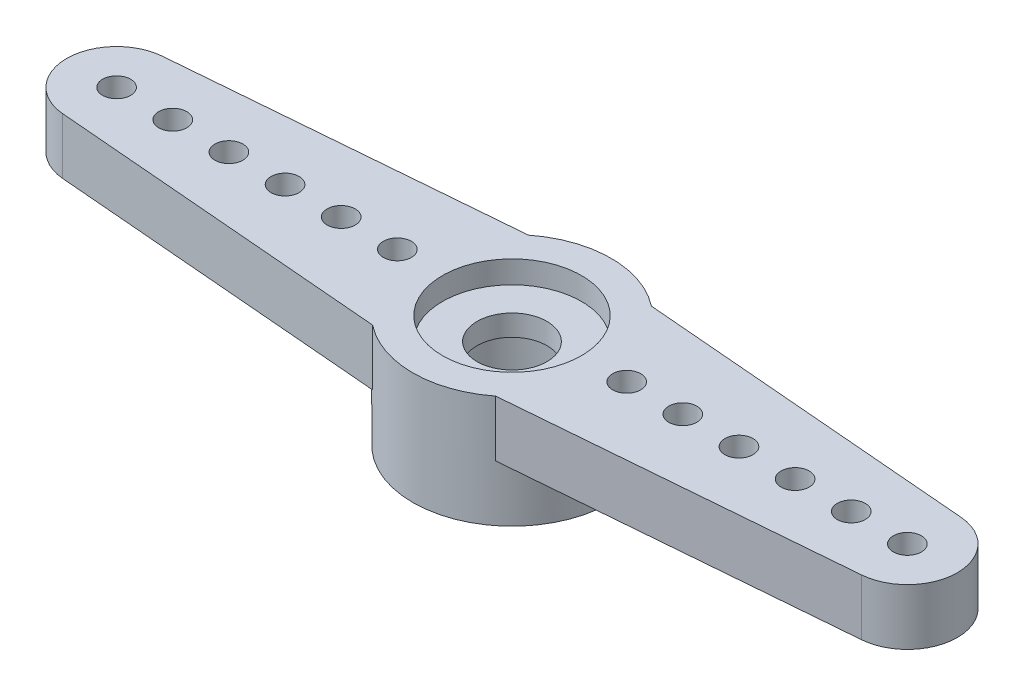
from build123d import *
from build123d.topology import SkipClean

# Parameters (mm, degrees)
BOSS_EXTRUDE1_START   = 2
BOSS_EXTRUDE1_DEPTH   = 2
MIRROR_START          = 2
MIRROR_2_COPY_1_DEPTH = 2
MIRROR_2_COPY_2_DEPTH = 2


with BuildPart() as part:
    # Sketch2 → Revolve1 (revolve)
    with BuildSketch(Plane.XY, mode=Mode.PRIVATE) as revolve1_sk:
        Polygon((2.475, 2), (2.475, 1.2), (1.245, 1.2), (1.245, 0.45), (2.375, 0.45), (2.375, -2), (3.535, -2), (3.535, 2), align=None)
    revolve(revolve1_sk.sketch.rotate(Axis((0, 55, 0), (0, -1, 0)), 90), axis=Axis((0, 55, 0), (0, -1, 0)))

    # Sketch3 → Boss-Extrude1 (add)
    with BuildSketch(Plane(origin=(0, 0, 0), x_dir=(1, 0, 0), z_dir=(0, 1, 0)).offset(BOSS_EXTRUDE1_START)):
        with BuildLine():
            ThreePointArc((3.535, 0), (3.180996027, -1.541910917), (2.189885842, -2.775))
            Line((2.189885842, -2.775), (14.232465575, -1.773881029))
            ThreePointArc((14.232465575, -1.773881029), (13.044016702, -1.443867644), (12.3554, -0.420575606))
            ThreePointArc((12.3554, -0.420575606), (11.845417029, -0.438862165), (11.585, 0))
            Line((11.585, 0), (10.585, 0))
            ThreePointArc((10.585, 0), (10.085, -0.5), (9.585, 0))
            Line((9.585, 0), (8.585, 0))
            ThreePointArc((8.585, 0), (8.085, -0.5), (7.585, 0))
            Line((7.585, 0), (6.585, 0))
            ThreePointArc((6.585, 0), (6.085, -0.5), (5.585, 0))
            Line((5.585, 0), (4.585, 0))
            ThreePointArc((4.585, 0), (4.085, -0.5), (3.585, 0))
            Line((3.585, 0), (3.535, 0))
        make_face()
        with BuildLine():
            ThreePointArc((12.3554, -0.420575606), (13.044016702, -1.443867644), (14.232465575, -1.773881029))
            ThreePointArc((14.232465575, -1.773881029), (15.394749733, -1.205386095), (15.865, 0))
            Line((15.865, 0), (14.585, 0))
            ThreePointArc((14.585, 0), (14.085, -0.5), (13.585, 0))
            Line((13.585, 0), (12.585, 0))
            ThreePointArc((12.585, 0), (12.523862165, -0.239582971), (12.3554, -0.420575606))
        make_face()
    boss_extrude1 = extrude(amount=-BOSS_EXTRUDE1_DEPTH)

    # Mirror1: Boss-Extrude1 across plane
    with SkipClean():  # the faces are left unmerged after this step: merging them gives an invalid solid
        add(boss_extrude1.mirror(Plane(origin=(0, 15.95383002, 0), x_dir=(1, 0, 0), z_dir=(0, 0, -1))))

    # 镜向1: Boss-Extrude1 across plane
    with SkipClean():  # the faces are left unmerged after this step: merging them gives an invalid solid
        add(boss_extrude1.mirror(Plane(origin=(0, 0, 0), x_dir=(0, 0, 1), z_dir=(1, 0, 0))))

    # 镜向2 copy 1 sketch → 镜向2 copy 1 (add)
    with SkipClean():  # the faces are left unmerged after this step: merging them gives an invalid solid
        with BuildSketch(Plane(origin=(0, 0, 0), x_dir=(-1, 0, 0), z_dir=(0, 1, 0)).offset(MIRROR_START)):
            with BuildLine():
                ThreePointArc((3.535, 0), (3.180996027, -1.541910917), (2.189885842, -2.775))
                Line((2.189885842, -2.775), (14.232465575, -1.773881029))
                ThreePointArc((14.232465575, -1.773881029), (13.044016702, -1.443867644), (12.3554, -0.420575606))
                ThreePointArc((12.3554, -0.420575606), (11.845417029, -0.438862165), (11.585, 0))
                Line((11.585, 0), (10.585, 0))
                ThreePointArc((10.585, 0), (10.085, -0.5), (9.585, 0))
                Line((9.585, 0), (8.585, 0))
                ThreePointArc((8.585, 0), (8.085, -0.5), (7.585, 0))
                Line((7.585, 0), (6.585, 0))
                ThreePointArc((6.585, 0), (6.085, -0.5), (5.585, 0))
                Line((5.585, 0), (4.585, 0))
                ThreePointArc((4.585, 0), (4.085, -0.5), (3.585, 0))
                Line((3.585, 0), (3.535, 0))
            make_face()
            with BuildLine():
                ThreePointArc((12.3554, -0.420575606), (13.044016702, -1.443867644), (14.232465575, -1.773881029))
                ThreePointArc((14.232465575, -1.773881029), (15.394749733, -1.205386095), (15.865, 0))
                Line((15.865, 0), (14.585, 0))
                ThreePointArc((14.585, 0), (14.085, -0.5), (13.585, 0))
                Line((13.585, 0), (12.585, 0))
                ThreePointArc((12.585, 0), (12.523862165, -0.239582971), (12.3554, -0.420575606))
            make_face()
        extrude(amount=-MIRROR_2_COPY_1_DEPTH)

    # 镜向2 copy 2 sketch → 镜向2 copy 2 (add)
    with SkipClean():  # the faces are left unmerged after this step: merging them gives an invalid solid
        with BuildSketch(Plane(origin=(0, 0, 0), x_dir=(1, 0, 0), z_dir=(0, 1, 0)).offset(MIRROR_START)):
            with BuildLine():
                ThreePointArc((3.535, 0), (3.180996027, 1.541910917), (2.189885842, 2.775))
                Line((2.189885842, 2.775), (14.232465575, 1.773881029))
                ThreePointArc((14.232465575, 1.773881029), (13.044016702, 1.443867644), (12.3554, 0.420575606))
                ThreePointArc((12.3554, 0.420575606), (11.845417029, 0.438862165), (11.585, 0))
                Line((11.585, 0), (10.585, 0))
                ThreePointArc((10.585, 0), (10.085, 0.5), (9.585, 0))
                Line((9.585, 0), (8.585, 0))
                ThreePointArc((8.585, 0), (8.085, 0.5), (7.585, 0))
                Line((7.585, 0), (6.585, 0))
                ThreePointArc((6.585, 0), (6.085, 0.5), (5.585, 0))
                Line((5.585, 0), (4.585, 0))
                ThreePointArc((4.585, 0), (4.085, 0.5), (3.585, 0))
                Line((3.585, 0), (3.535, 0))
            make_face()
            with BuildLine():
                ThreePointArc((12.3554, 0.420575606), (13.044016702, 1.443867644), (14.232465575, 1.773881029))
                ThreePointArc((14.232465575, 1.773881029), (15.394749733, 1.205386095), (15.865, 0))
                Line((15.865, 0), (14.585, 0))
                ThreePointArc((14.585, 0), (14.085, 0.5), (13.585, 0))
                Line((13.585, 0), (12.585, 0))
                ThreePointArc((12.585, 0), (12.523862165, 0.239582971), (12.3554, 0.420575606))
            make_face()
        extrude(amount=-MIRROR_2_COPY_2_DEPTH)


solid = part.part
